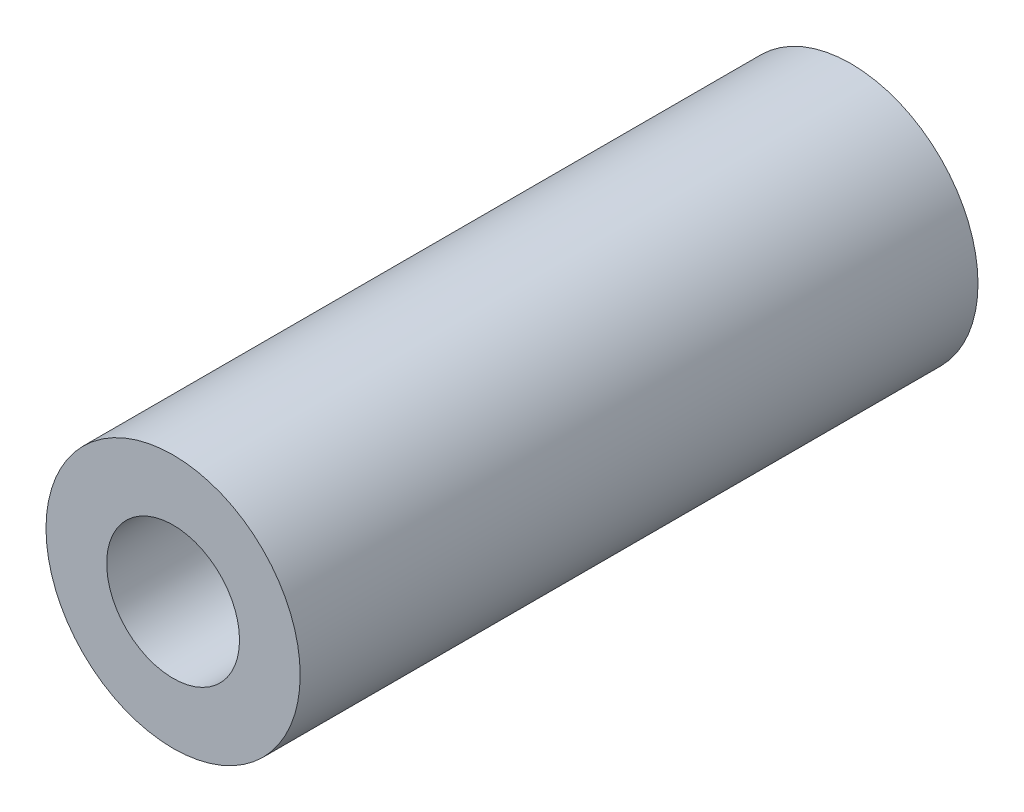
from build123d import *

# Parameters (mm, degrees)
SKETCH1_R           = 4.7625
SKETCH1_R_2         = 2.4892
BOSS_EXTRUDE1_DEPTH = 25.4


with BuildPart() as part:
    # Sketch1 → Boss-Extrude1 (new body)
    with BuildSketch(Plane.XY):
        Circle(SKETCH1_R)
        Circle(SKETCH1_R_2, mode=Mode.SUBTRACT)
    extrude(amount=BOSS_EXTRUDE1_DEPTH)


solid = part.part
